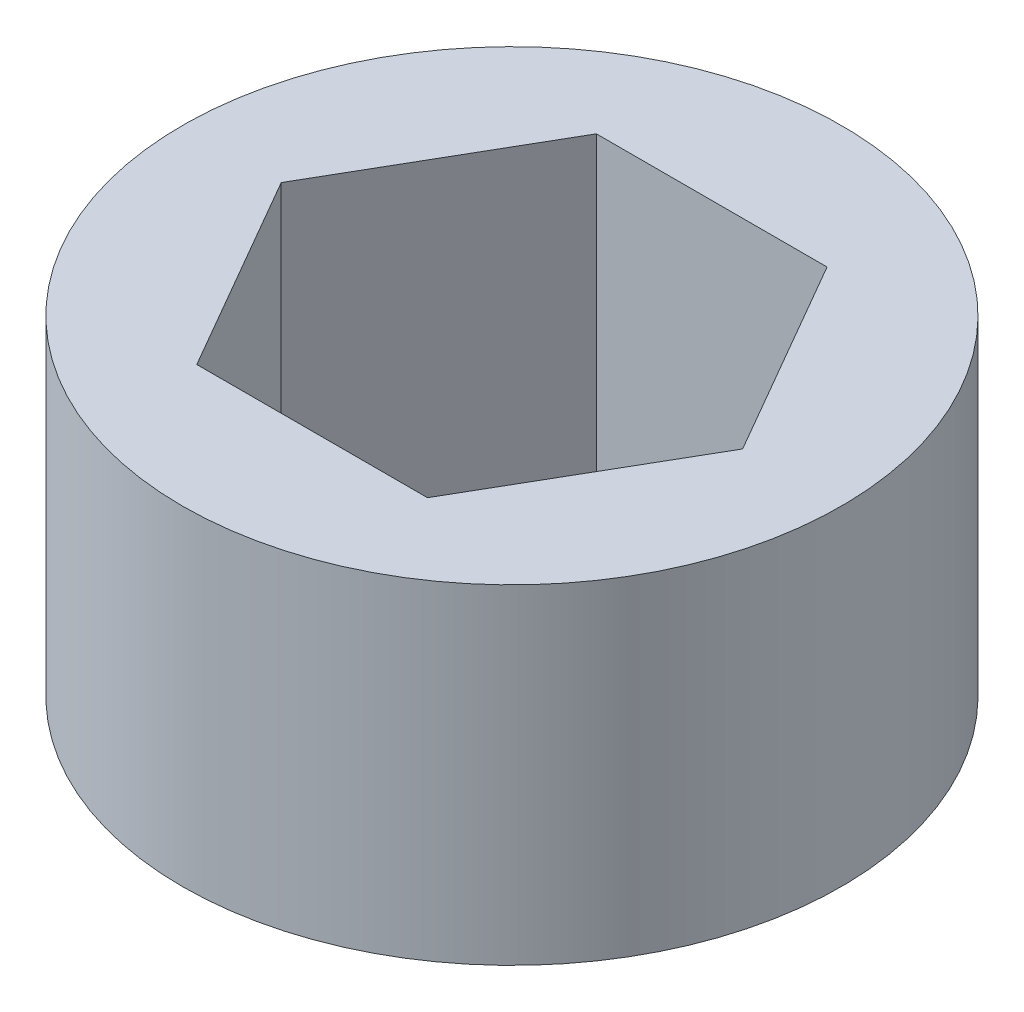
from build123d import *

# Parameters (mm, degrees)
SKETCH1_R           = 6.35
BOSS_EXTRUDE1_DEPTH = 6.35
CUT_EXTRUDE1_DEPTH  = 11.998522628


with BuildPart() as part:
    # Sketch1 → Boss-Extrude1 (new body)
    with BuildSketch(Plane(origin=(0, 0, 0), x_dir=(1, 0, 0), z_dir=(0, 1, 0))):
        with Locations(Location((0, 0, 0), (0, 0, 270))):
            Circle(SKETCH1_R)
    extrude(amount=-BOSS_EXTRUDE1_DEPTH)

    # Sketch2 → Cut-Extrude1 (cut, through all)
    with BuildSketch(Plane(origin=(0, 0, 0), x_dir=(1, 0, 0), z_dir=(0, 1, 0))):
        Polygon((2.2225, 3.84948292), (-2.2225, 3.84948292), (-4.445, 0), (-2.2225, -3.84948292), (2.2225, -3.84948292), (4.445, 0), align=None)
    extrude(amount=-CUT_EXTRUDE1_DEPTH, mode=Mode.SUBTRACT)


solid = part.part
